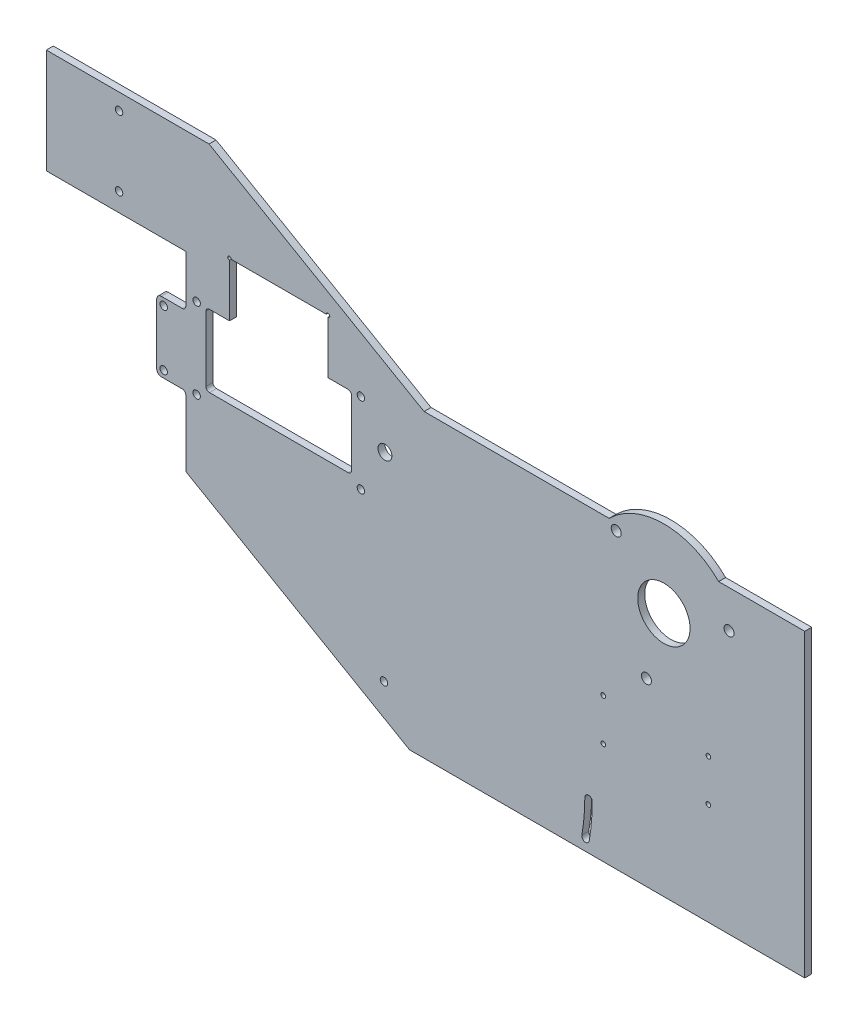
from build123d import *

# Parameters (mm, degrees)
SKETCH1_W           = 184.414327478
SKETCH1_H           = 83.61431582
BOSS_EXTRUDE1_DEPTH = 3
SKETCH2_R           = 3
CUT_EXTRUDE1_DEPTH  = 70
SKETCH3_R           = 11.25
CUT_EXTRUDE2_DEPTH  = 3
SKETCH4_R           = 1.6
BOSS_EXTRUDE2_DEPTH = 3
CUT_EXTRUDE3_DEPTH  = 10
SKETCH6_R           = 1.6
CUT_EXTRUDE4_DEPTH  = 3
FILLET1_R           = 1.5
SKETCH8_R           = 1.6
CUT_EXTRUDE6_DEPTH  = 12
SKETCH9_R           = 2.15
CUT_EXTRUDE7_DEPTH  = 12
BOSS_EXTRUDE3_DEPTH = 3
SKETCH12_R          = 1.6
CUT_EXTRUDE8_DEPTH  = 10
SKETCH13_R          = 1
CUT_EXTRUDE9_DEPTH  = 10


with BuildPart() as part:
    # Sketch1 → Boss-Extrude1 (new body)
    with BuildSketch(Plane.XY):
        with Locations((112.494062572, 5.79284209)):
            Rectangle(SKETCH1_W, SKETCH1_H)
    extrude(amount=BOSS_EXTRUDE1_DEPTH)

    # Sketch2 → Cut-Extrude1 (cut)
    with BuildSketch(Plane(origin=(0, 0, 0), x_dir=(-1, 0, 0), z_dir=(0, 0, -1))):
        with Locations((-24.116880081, 24)):
            Circle(SKETCH2_R)
    extrude(amount=-CUT_EXTRUDE1_DEPTH, mode=Mode.SUBTRACT)

    # Sketch3 → Cut-Extrude2 (cut)
    with BuildSketch(Plane.XY.offset(3)):
        with Locations((144.116880081, 24)):
            Circle(SKETCH3_R)
    extrude(amount=-CUT_EXTRUDE2_DEPTH, mode=Mode.SUBTRACT)

    # Sketch4 → Boss-Extrude2 (add)
    with BuildSketch(Plane.XY.offset(3)):
        with BuildLine():
            Line((-61.543119919, 56), (-61.543119919, 34))
            Line((-61.543119919, 34), (-72.043119919, 34))
            ThreePointArc((-72.043119919, 34), (-73.457333481, 33.414213562), (-74.043119919, 32))
            Line((-74.043119919, 32), (-74.043119919, 6))
            ThreePointArc((-74.043119919, 6), (-73.457333481, 4.585786438), (-72.043119919, 4))
            Line((-72.043119919, 4), (-61.543119919, 4))
            Line((-61.543119919, 4), (-61.543119919, -26))
            Line((-61.543119919, -26), (34.701226311, -81.566699204))
            Line((34.701226311, -81.566699204), (204.701226311, -81.566699204))
            Line((204.701226311, -81.566699204), (204.701226311, -36.01431582))
            Line((204.701226311, -36.01431582), (20.286898833, -36.01431582))
            Line((20.286898833, -36.01431582), (20.286898833, 47.6))
            Line((20.286898833, 47.6), (40.948393205, 47.6))
            Line((40.948393205, 47.6), (-51.543119919, 101))
            Line((-51.543119919, 101), (-121.543119919, 101))
            Line((-121.543119919, 101), (-121.543119919, 56))
            Line((-121.543119919, 56), (-61.543119919, 56))
        make_face()
        with Locations((-71.043119919, 31)):
            Circle(SKETCH4_R, mode=Mode.SUBTRACT)
        with Locations((-71.043119919, 7)):
            Circle(SKETCH4_R, mode=Mode.SUBTRACT)
    extrude(amount=-BOSS_EXTRUDE2_DEPTH)

    # Sketch5 → Cut-Extrude3 (cut)
    with BuildSketch(Plane.XY.offset(3)):
        with BuildLine():
            Line((8.286898833, 8.5), (-51.373138671, 8.5))
            ThreePointArc((-51.373138671, 8.5), (-52.433798843, 8.939339828), (-52.873138671, 10))
            Line((-52.873138671, 10), (-52.873138671, 38))
            ThreePointArc((-52.873138671, 38), (-52.433798843, 39.060660172), (-51.373138671, 39.5))
            Line((-51.373138671, 39.5), (-42.743119919, 39.5))
            Line((-42.743119919, 39.5), (-42.743119919, 62.05))
            ThreePointArc((-42.743119919, 62.05), (-43.273450005, 63.330330086), (-41.993119919, 62.8))
            Line((-41.993119919, 62.8), (-1.093119919, 62.8))
            ThreePointArc((-1.093119919, 62.8), (0.187210167, 63.330330086), (-0.343119919, 62.05))
            Line((-0.343119919, 62.05), (-0.343119919, 39.5))
            Line((-0.343119919, 39.5), (8.286898833, 39.5))
            ThreePointArc((8.286898833, 39.5), (9.347559005, 39.060660172), (9.786898833, 38))
            Line((9.786898833, 38), (9.786898833, 10))
            ThreePointArc((9.786898833, 10), (9.347559005, 8.939339828), (8.286898833, 8.5))
        make_face()
    extrude(amount=-CUT_EXTRUDE3_DEPTH, mode=Mode.SUBTRACT)

    # Sketch6 → Cut-Extrude4 (cut)
    with BuildSketch(Plane.XY.offset(3)):
        with Locations((13.786898833, 5)):
            Circle(SKETCH6_R)
        with Locations((13.786898833, 39.6)):
            Circle(SKETCH6_R)
        with Locations((-56.873138671, 5)):
            Circle(SKETCH6_R)
        with Locations((-56.873138671, 39.6)):
            Circle(SKETCH6_R)
    extrude(amount=-CUT_EXTRUDE4_DEPTH, mode=Mode.SUBTRACT)

    # Fillet1
    fillet1_edges = [part.edges().sort_by_distance(p)[0] for p in [
        (-61.543119919, 4, 1.5),
        (-61.543119919, 34, 1.5),
    ]]
    fillet(fillet1_edges, radius=FILLET1_R)

    # Sketch8 → Cut-Extrude6 (cut)
    with BuildSketch(Plane.XY.offset(3)):
        with Locations((-90.243119919, 94)):
            Circle(SKETCH8_R)
        with Locations((-90.243119919, 64)):
            Circle(SKETCH8_R)
    extrude(amount=-CUT_EXTRUDE6_DEPTH, mode=Mode.SUBTRACT)

    # Sketch9 → Cut-Extrude7 (cut)
    with BuildSketch(Plane(origin=(0, 0, 0), x_dir=(-1, 0, 0), z_dir=(0, 0, -1))):
        with Locations((-172.128729044, 31.505752308)):
            Circle(SKETCH9_R)
        with Locations((-123.610783427, 44.506096654)):
            Circle(SKETCH9_R)
        with Locations((-136.611127773, -4.011848962)):
            Circle(SKETCH9_R)
    extrude(amount=-CUT_EXTRUDE7_DEPTH, mode=Mode.SUBTRACT)

    # Sketch10 → Boss-Extrude3 (add)
    with BuildSketch(Plane(origin=(0, 0, 0), x_dir=(-1, 0, 0), z_dir=(0, 0, -1))):
        with BuildLine():
            Line((-167.680888654, 47.6), (-120.552871509, 47.6))
            ThreePointArc((-120.552871509, 47.6), (-144.116880081, 57.35), (-167.680888654, 47.6))
        make_face()
    extrude(amount=-BOSS_EXTRUDE3_DEPTH)

    # Sketch12 → Cut-Extrude8 (cut)
    with BuildSketch(Plane.XY.offset(3)):
        with Locations((23.701226311, -61.566699204)):
            Circle(SKETCH12_R)
        with BuildLine():
            ThreePointArc((110.101226311, -61.566699204), (109.784541603, -68.957425033), (108.836808989, -76.293971931))
            ThreePointArc((108.836808989, -76.293971931), (110.140666581, -78.143284068), (111.989978718, -76.839426476))
            ThreePointArc((111.989978718, -76.839426476), (112.97281254, -69.231155619), (113.301226311, -61.566699204))
            ThreePointArc((113.301226311, -61.566699204), (111.701226311, -59.966699204), (110.101226311, -61.566699204))
        make_face()
    extrude(amount=-CUT_EXTRUDE8_DEPTH, mode=Mode.SUBTRACT)

    # Sketch13 → Cut-Extrude9 (cut)
    with BuildSketch(Plane(origin=(0, 0, 0), x_dir=(-1, 0, 0), z_dir=(0, 0, -1))):
        with Locations((-163.256880081, -19.666699204)):
            Circle(SKETCH13_R)
        with Locations((-163.256880081, -37.666699204)):
            Circle(SKETCH13_R)
        with Locations((-118.056880081, -19.666699204)):
            Circle(SKETCH13_R)
        with Locations((-118.056880081, -37.666699204)):
            Circle(SKETCH13_R)
    extrude(amount=-CUT_EXTRUDE9_DEPTH, mode=Mode.SUBTRACT)


solid = part.part
